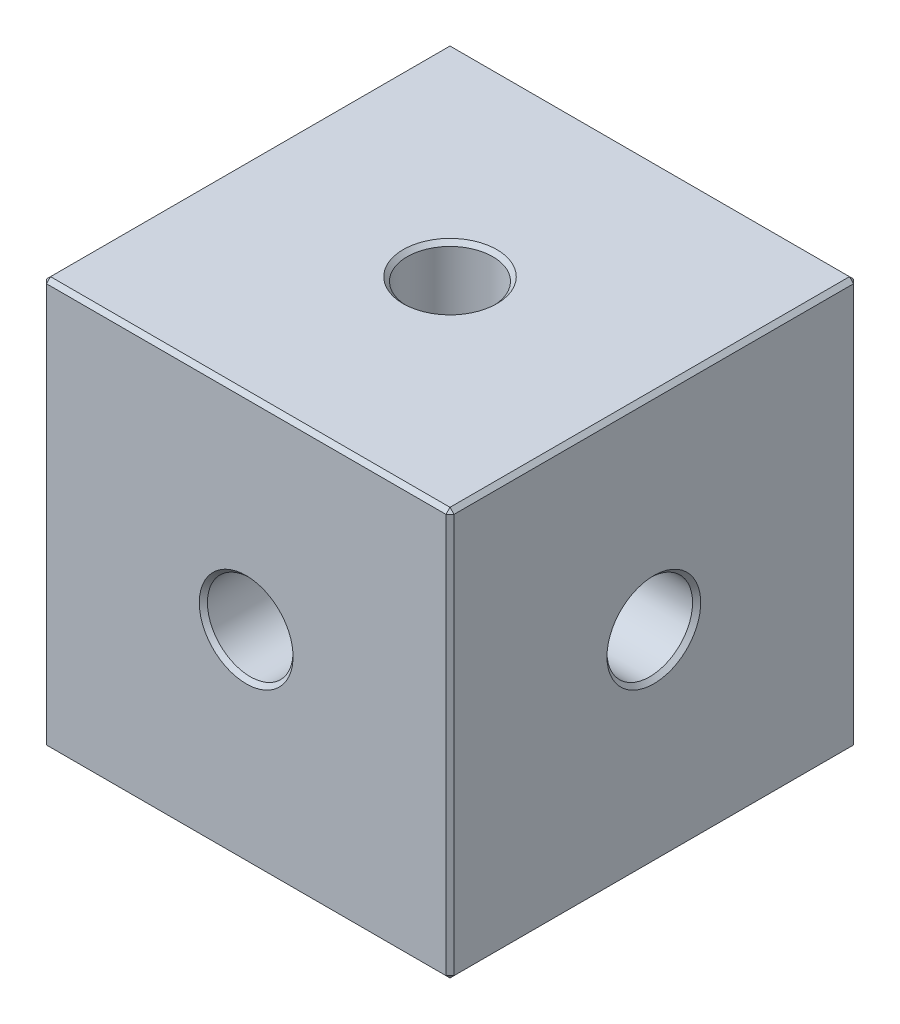
from build123d import *

# Parameters (mm, degrees)
SKETCH_1_W         = 20
SKETCH_1_H         = 20
EXTRUDE_1_DEPTH    = 10
HOLE_WIZARD_M5_1_D = 4.2
HOLE_WIZARD_M5_2_D = 4.2
HOLE_WIZARD_M5_3_D = 4.2
CHAMFER_1_SIZE     = 0.2


with BuildPart() as part:
    # 草图1 → 凸台-拉伸1 (new, symmetric)
    with BuildSketch(Plane(origin=(0, 0, 0), x_dir=(1, 0, 0), z_dir=(0, 1, 0))):
        Rectangle(SKETCH_1_W, SKETCH_1_H)
    extrude(amount=EXTRUDE_1_DEPTH, both=True)

    # M5 螺纹孔1 (through all)
    with Locations(Plane.XY.offset(10)):
        with Locations((0, 0)):
            Hole(HOLE_WIZARD_M5_1_D / 2)

    # M5 螺纹孔2 (through all)
    with Locations(Plane(origin=(0, 10, 0), x_dir=(1, 0, 0), z_dir=(0, 1, 0))):
        with Locations((0, 0)):
            Hole(HOLE_WIZARD_M5_2_D / 2)

    # M5 螺纹孔3 (through all)
    with Locations(Plane(origin=(10, 0, 0), x_dir=(0, 0, -1), z_dir=(1, 0, 0))):
        with Locations((0, 0)):
            Hole(HOLE_WIZARD_M5_3_D / 2)

    # 倒角1
    chamfer_1_edges = [part.edges().sort_by_distance(p)[0] for p in [
        (-10, 10, 0),
        (2.1, 0, 10),
        (2.1, 0, -10),
        (0, 10, 10),
        (2.1, -10, 0),
        (2.1, 10, 0),
        (-10, 0, -2.1),
        (10, 0, -2.1),
        (10, 10, 0),
        (0, -10, 10),
        (-10, -10, 0),
        (0, -10, -10),
        (10, -10, 0),
        (10, 0, 10),
        (-10, 0, 10),
        (-10, 0, -10),
        (10, 0, -10),
        (0, 10, -10),
    ]]
    chamfer(chamfer_1_edges, length=CHAMFER_1_SIZE)


solid = part.part
